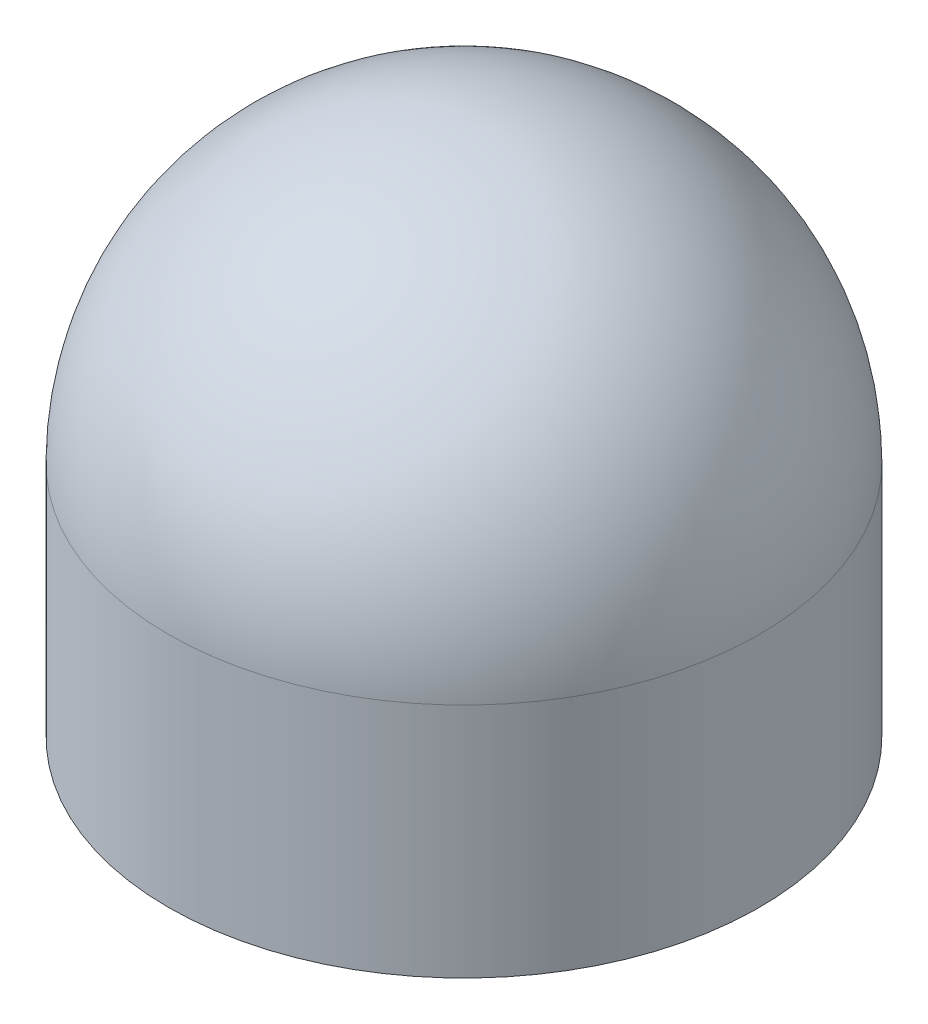
from build123d import *

# Parameters (mm, degrees)
SKETCH1_R           = 25
BOSS_EXTRUDE1_DEPTH = 20


with BuildPart() as part:
    # Sketch1 → Boss-Extrude1 (new body)
    with BuildSketch(Plane(origin=(0, 0, 0), x_dir=(1, 0, 0), z_dir=(0, 1, 0))):
        with Locations(Location((0, 0, 0), (0, 0, 270))):
            Circle(SKETCH1_R)
    extrude(amount=BOSS_EXTRUDE1_DEPTH)

    # Sketch2 → Revolve1 (revolve)
    with BuildSketch(Plane(origin=(0, 20, 0), x_dir=(1, 0, 0), z_dir=(0, 1, 0))):
        with BuildLine():
            Line((0, 25), (0, -25))
            ThreePointArc((0, -25), (25, 0), (0, 25))
        make_face()
    revolve(axis=Axis((0, 20, -25), (0, 0, 1)))


solid = part.part
